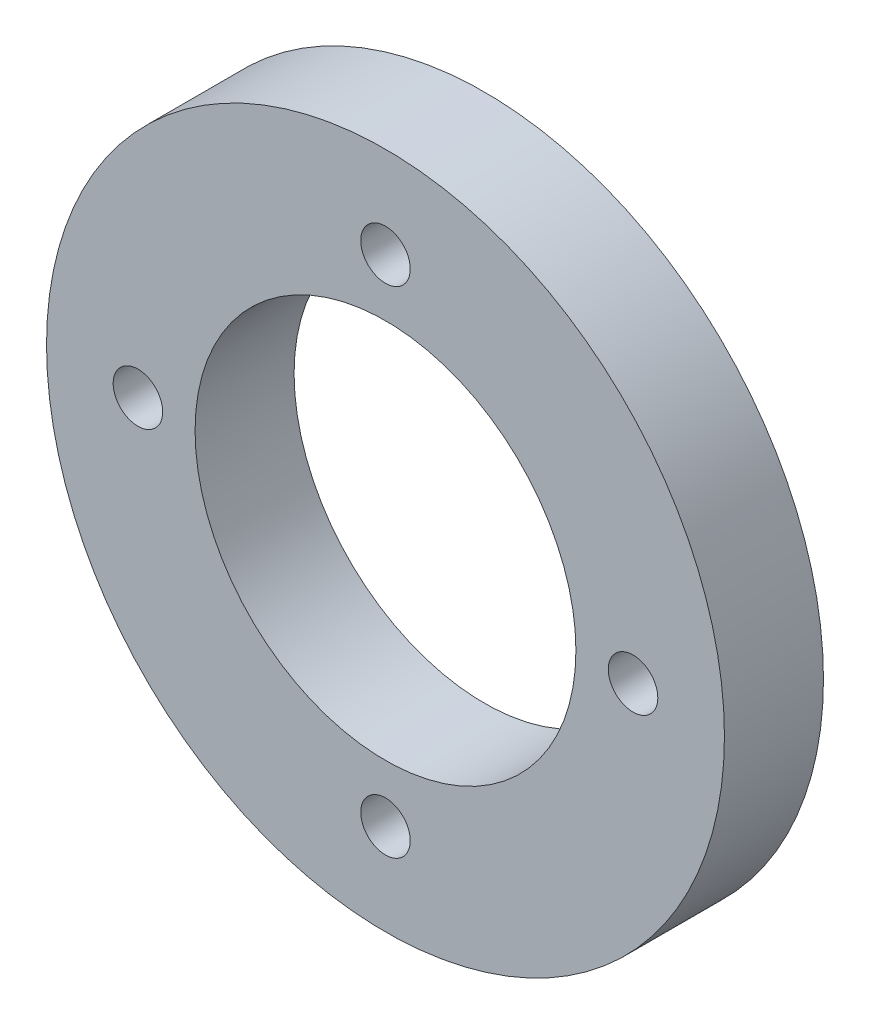
from build123d import *

# Parameters (mm, degrees)
SKETCH1_R           = 17.8
SKETCH1_R_2         = 10
SKETCH1_R_3         = 1.3
BOSS_EXTRUDE1_DEPTH = 5.2


with BuildPart() as part:
    # Sketch1 → Boss-Extrude1 (new body)
    with BuildSketch(Plane.XY):
        Circle(SKETCH1_R)
        Circle(SKETCH1_R_2, mode=Mode.SUBTRACT)
        with Locations((0, 13)):
            Circle(SKETCH1_R_3, mode=Mode.SUBTRACT)
        with Locations((13, 0)):
            Circle(SKETCH1_R_3, mode=Mode.SUBTRACT)
        with Locations((0, -13)):
            Circle(SKETCH1_R_3, mode=Mode.SUBTRACT)
        with Locations((-13, 0)):
            Circle(SKETCH1_R_3, mode=Mode.SUBTRACT)
    extrude(amount=BOSS_EXTRUDE1_DEPTH)


solid = part.part
